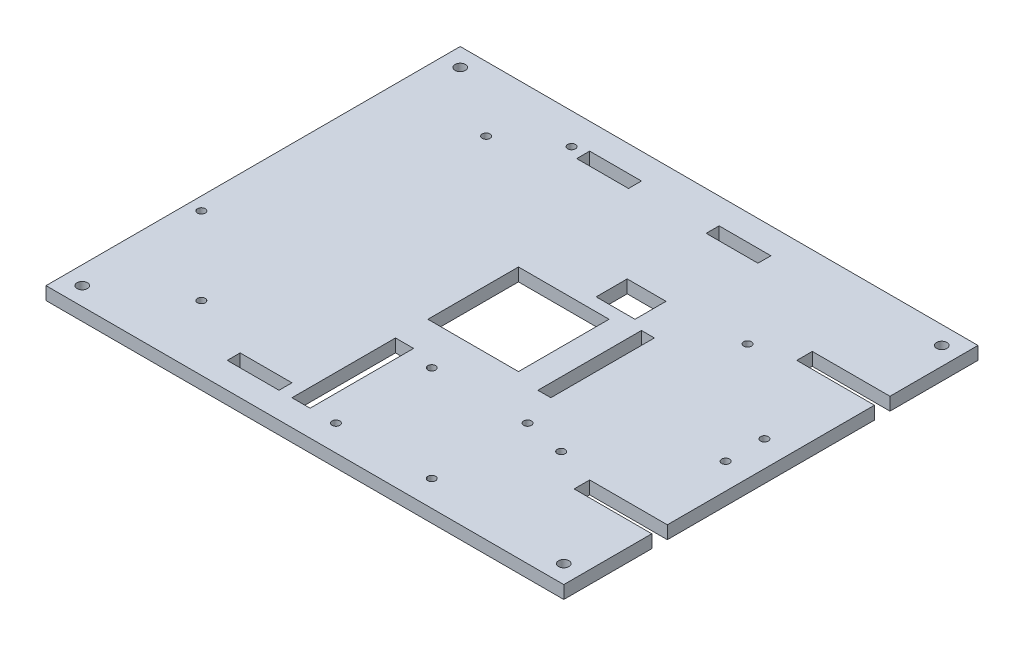
from build123d import *

# Parameters (mm, degrees)
SKETCH1_W           = 200
SKETCH1_H           = 160
BOSS_EXTRUDE1_DEPTH = 5
SKETCH2_R           = 2
CUT_EXTRUDE1_DEPTH  = 5
SKETCH3_R           = 1.5
CUT_EXTRUDE4_DEPTH  = 5
SKETCH4_R           = 1.5
CUT_EXTRUDE5_DEPTH  = 5
SKETCH5_W           = 35
SKETCH5_H           = 35
CUT_EXTRUDE6_DEPTH  = 5
SKETCH7_W           = 7
SKETCH7_H           = 40
SKETCH7_W_2         = 5
SKETCH7_W_3         = 20
SKETCH7_H_2         = 5
CUT_EXTRUDE7_DEPTH  = 5
SKETCH8_W           = 15
SKETCH8_H           = 12
SKETCH8_W_2         = 30
SKETCH8_H_2         = 6
CUT_EXTRUDE8_DEPTH  = 5
SKETCH9_W           = 20
SKETCH9_H           = 5
CUT_EXTRUDE9_DEPTH  = 5
SKETCH10_R          = 1.5
CUT_EXTRUDE10_DEPTH = 5
SKETCH11_R          = 1.5
CUT_EXTRUDE11_DEPTH = 5
SKETCH12_R          = 1.5
CUT_EXTRUDE12_DEPTH = 5


with BuildPart() as part:
    # Sketch1 → Boss-Extrude1 (new body)
    with BuildSketch(Plane(origin=(0, 0, 0), x_dir=(1, 0, 0), z_dir=(0, 1, 0))):
        Rectangle(SKETCH1_W, SKETCH1_H)
    extrude(amount=BOSS_EXTRUDE1_DEPTH)

    # Sketch2 → Cut-Extrude1 (cut)
    with BuildSketch(Plane(origin=(0, 5, 0), x_dir=(1, 0, 0), z_dir=(0, 1, 0))):
        with Locations(Location((-93, 73, 0), (0, 0, 270))):
            Circle(SKETCH2_R)
        with Locations(Location((93, 73, 0), (0, 0, 90))):
            Circle(SKETCH2_R)
        with Locations(Location((93, -73, 0), (0, 0, 270))):
            Circle(SKETCH2_R)
        with Locations(Location((-93, -73, 0), (0, 0, 90))):
            Circle(SKETCH2_R)
    extrude(amount=-CUT_EXTRUDE1_DEPTH, mode=Mode.SUBTRACT)

    # Sketch3 → Cut-Extrude4 (cut)
    with BuildSketch(Plane(origin=(0, 5, 0), x_dir=(1, 0, 0), z_dir=(0, 1, 0))):
        with Locations(Location((90, 7.5, 0), (0, 0, 270))):
            Circle(SKETCH3_R)
        with Locations(Location((90, -7.5, 0), (0, 0, 90))):
            Circle(SKETCH3_R)
    extrude(amount=-CUT_EXTRUDE4_DEPTH, mode=Mode.SUBTRACT)

    # Sketch4 → Cut-Extrude5 (cut)
    with BuildSketch(Plane(origin=(0, 5, 0), x_dir=(1, 0, 0), z_dir=(0, 1, 0))):
        with Locations(Location((55, 36, 0), (0, 0, 270))):
            Circle(SKETCH4_R)
        with Locations(Location((55, -36, 0), (0, 0, 90))):
            Circle(SKETCH4_R)
    extrude(amount=-CUT_EXTRUDE5_DEPTH, mode=Mode.SUBTRACT)

    # Sketch5 → Cut-Extrude6 (cut)
    with BuildSketch(Plane(origin=(0, 5, 0), x_dir=(1, 0, 0), z_dir=(0, 1, 0))):
        with Locations((2.5, 0)):
            Rectangle(SKETCH5_W, SKETCH5_H)
    extrude(amount=-CUT_EXTRUDE6_DEPTH, mode=Mode.SUBTRACT)

    # Sketch7 → Cut-Extrude7 (cut)
    with BuildSketch(Plane(origin=(0, 5, 0), x_dir=(1, 0, 0), z_dir=(0, 1, 0))):
        with Locations((-11.5, -50)):
            Rectangle(SKETCH7_W, SKETCH7_H)
        with Locations((32.5, 0)):
            Rectangle(SKETCH7_W_2, SKETCH7_H)
        with Locations((-30, 67.5)):
            Rectangle(SKETCH7_W_3, SKETCH7_H_2)
        with Locations((-30, -67.5)):
            Rectangle(SKETCH7_W_3, SKETCH7_H_2)
    extrude(amount=-CUT_EXTRUDE7_DEPTH, mode=Mode.SUBTRACT)

    # Sketch8 → Cut-Extrude8 (cut)
    with BuildSketch(Plane(origin=(0, 5, 0), x_dir=(1, 0, 0), z_dir=(0, 1, 0))):
        with Locations((17.5, 28.5)):
            Rectangle(SKETCH8_W, SKETCH8_H)
        with Locations((85, 43)):
            Rectangle(SKETCH8_W_2, SKETCH8_H_2)
        with Locations((85, -43)):
            Rectangle(SKETCH8_W_2, SKETCH8_H_2)
    extrude(amount=-CUT_EXTRUDE8_DEPTH, mode=Mode.SUBTRACT)

    # Sketch9 → Cut-Extrude9 (cut)
    with BuildSketch(Plane(origin=(0, 5, 0), x_dir=(1, 0, 0), z_dir=(0, 1, 0))):
        with Locations((20, 67.5)):
            Rectangle(SKETCH9_W, SKETCH9_H)
    extrude(amount=-CUT_EXTRUDE9_DEPTH, mode=Mode.SUBTRACT)

    # Sketch10 → Cut-Extrude10 (cut)
    with BuildSketch(Plane(origin=(0, 5, 0), x_dir=(1, 0, 0), z_dir=(0, 1, 0))):
        with Locations(Location((-95, -25, 0), (0, 0, 270))):
            Circle(SKETCH10_R)
        with Locations(Location((-45, 68, 0), (0, 0, 270))):
            Circle(SKETCH10_R)
    extrude(amount=-CUT_EXTRUDE10_DEPTH, mode=Mode.SUBTRACT)

    # Sketch11 → Cut-Extrude11 (cut)
    with BuildSketch(Plane(origin=(0, 5, 0), x_dir=(1, 0, 0), z_dir=(0, 1, 0))):
        with Locations(Location((2, -33, 0), (0, 0, 270))):
            Circle(SKETCH11_R)
        with Locations(Location((2, -70, 0), (0, 0, 90))):
            Circle(SKETCH11_R)
        with Locations(Location((39, -70, 0), (0, 0, 270))):
            Circle(SKETCH11_R)
        with Locations(Location((39, -33, 0), (0, 0, 90))):
            Circle(SKETCH11_R)
    extrude(amount=-CUT_EXTRUDE11_DEPTH, mode=Mode.SUBTRACT)

    # Sketch12 → Cut-Extrude12 (cut)
    with BuildSketch(Plane(origin=(0, 5, 0), x_dir=(1, 0, 0), z_dir=(0, 1, 0))):
        with Locations(Location((-65, 55, 0), (0, 0, 270))):
            Circle(SKETCH12_R)
        with Locations(Location((-65, -55, 0), (0, 0, 90))):
            Circle(SKETCH12_R)
    extrude(amount=-CUT_EXTRUDE12_DEPTH, mode=Mode.SUBTRACT)


solid = part.part
